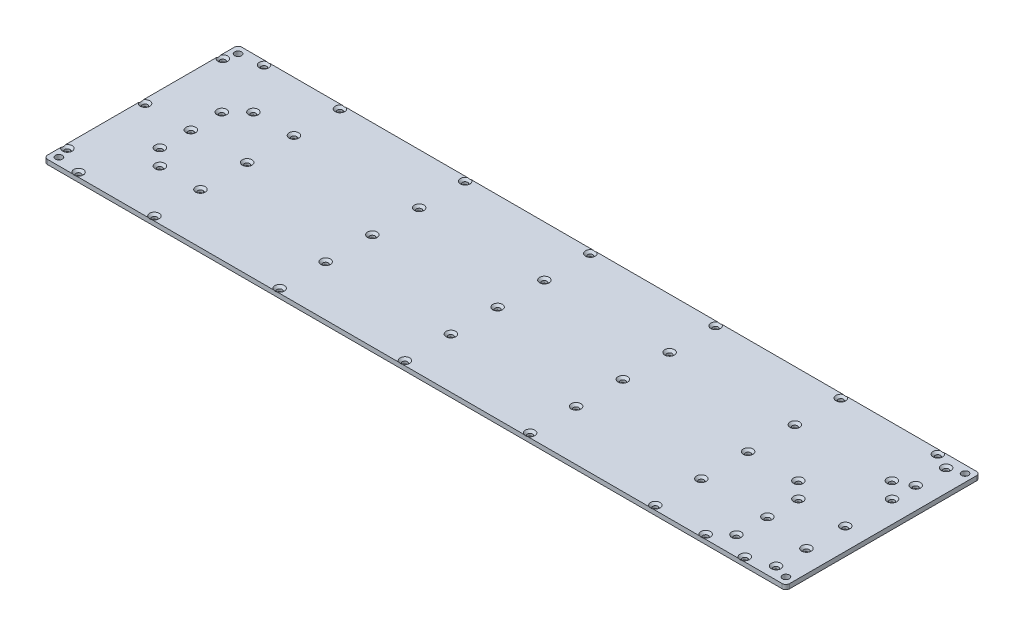
from build123d import *

# Parameters (mm, degrees)
SKETCH1_W                                       = 488.95
SKETCH1_H                                       = 128
BOSS_EXTRUDE1_DEPTH                             = 3
M4_CLEARANCE_HOLE1_D                            = 4.5
M4_CLEARANCE_HOLE1_DEPTH                        = 17.38
M4_CLEARANCE_HOLE1_TIP                          = 1.351936393
FILLET1_R                                       = 2.5
CSK_FOR_M3_FLAT_HEAD_MACHINE_SCREW1_D           = 3.4
CSK_FOR_M3_FLAT_HEAD_MACHINE_SCREW1_DEPTH       = 10
CSK_FOR_M3_FLAT_HEAD_MACHINE_SCREW1_CSINK_D     = 6.3
CSK_FOR_M3_FLAT_HEAD_MACHINE_SCREW1_CSINK_ANGLE = 90
CSK_FOR_M3_FLAT_HEAD_MACHINE_SCREW1_TIP         = 1.021463052


with BuildPart() as part:
    # Sketch1 → Boss-Extrude1 (new body)
    with BuildSketch(Plane(origin=(0, 0, 0), x_dir=(1, 0, 0), z_dir=(0, 1, 0))):
        Rectangle(SKETCH1_W, SKETCH1_H)
    extrude(amount=BOSS_EXTRUDE1_DEPTH)

    # M4 Clearance Hole1
    with Locations(Plane(origin=(0, 3, 0), x_dir=(1, 0, 0), z_dir=(0, 1, 0))):
        with Locations((-239.475, 59), (-239.475, -59), (239.475, -59), (239.475, 59)):
            Hole(M4_CLEARANCE_HOLE1_D / 2, depth=M4_CLEARANCE_HOLE1_DEPTH)
            with Locations((0, 0, -(M4_CLEARANCE_HOLE1_DEPTH + M4_CLEARANCE_HOLE1_TIP / 2))):  # 118° drill point
                Cone(0, M4_CLEARANCE_HOLE1_D / 2, M4_CLEARANCE_HOLE1_TIP, mode=Mode.SUBTRACT)

    # Fillet1
    fillet1_edges = [part.edges().sort_by_distance(p)[0] for p in [
        (244.475, 1.5, 64),
        (-244.475, 1.5, 64),
        (-244.475, 1.5, -64),
        (244.475, 1.5, -64),
    ]]
    fillet(fillet1_edges, radius=FILLET1_R)

    # CSK for M3 Flat Head Machine Screw1
    with Locations(Plane(origin=(0, 3, 0), x_dir=(1, 0, 0), z_dir=(0, 1, 0))):
        with Locations((229.975, -56), (229.975, -36), (229.975, -10.4), (229.975, 20.4), (219.475, 30.8), (229.975, 56), (155.525, 61.1), (188.675, -61.1), (199.075, -51.2), (199.075, -30.8), (229.975, 36), (219.475, 61.1), (155.525, 30.8), (73.025, 30.8), (73.025, 61.1), (-9.475, 30.8), (-9.475, 61.1), (-91.975, 61.1), (-91.975, 30.8), (214.475, -61.1), (155.525, -61.1), (155.525, -30.8), (155.525, 0), (188.675, 0), (199.075, -10.4), (73.025, -30.8), (73.025, -61.1), (73.025, 0), (-91.975, -30.8), (-91.975, 0), (-91.975, -61.1), (-9.475, 0), (-9.475, -30.8), (-9.475, -61.1), (-201.175, 30.8), (-174.475, 30.8), (-174.475, 0), (-174.475, -30.8), (-174.475, -61.1), (-201.175, -30.8), (-211.575, -20.4), (-211.575, 0), (-211.575, 20.4), (-241.725, 51.2), (-241.725, 0), (-241.725, -51.2), (-224.475, -61.1), (-174.475, 61.1), (-224.475, 61.1)):
            CounterSinkHole(CSK_FOR_M3_FLAT_HEAD_MACHINE_SCREW1_D / 2, CSK_FOR_M3_FLAT_HEAD_MACHINE_SCREW1_CSINK_D / 2, depth=CSK_FOR_M3_FLAT_HEAD_MACHINE_SCREW1_DEPTH, counter_sink_angle=CSK_FOR_M3_FLAT_HEAD_MACHINE_SCREW1_CSINK_ANGLE)
            with Locations((0, 0, -(CSK_FOR_M3_FLAT_HEAD_MACHINE_SCREW1_DEPTH + CSK_FOR_M3_FLAT_HEAD_MACHINE_SCREW1_TIP / 2))):  # 118° drill point
                Cone(0, CSK_FOR_M3_FLAT_HEAD_MACHINE_SCREW1_D / 2, CSK_FOR_M3_FLAT_HEAD_MACHINE_SCREW1_TIP, mode=Mode.SUBTRACT)


solid = part.part
